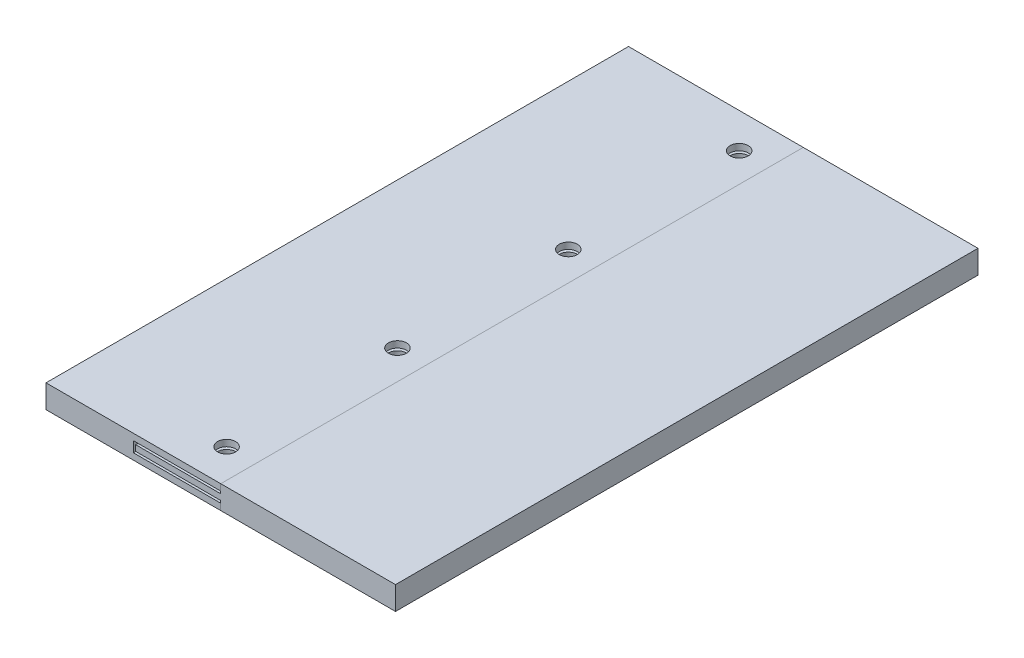
from build123d import *

# Parameters (mm, degrees)
SKETCH1_W           = 30
SKETCH1_H           = 100
BOSS_EXTRUDE1_DEPTH = 4
SKETCH3_W           = 15
SKETCH3_H           = 1.8
CUT_EXTRUDE1_DEPTH  = 100
SKETCH5_W           = 14.6
SKETCH5_H           = 1
BOSS_EXTRUDE3_DEPTH = 100
SKETCH6_R           = 1.55
CUT_EXTRUDE2_DEPTH  = 4


with BuildPart() as part:
    # Sketch1 → Boss-Extrude1 (new body)
    with BuildSketch(Plane(origin=(0, 0, 0), x_dir=(1, 0, 0), z_dir=(0, 1, 0))):
        with Locations((-15, -50)):
            Rectangle(SKETCH1_W, SKETCH1_H)
    extrude(amount=BOSS_EXTRUDE1_DEPTH)


with BuildPart() as body_2:
    # Mirror1: mirrored copy
    add(part.part.mirror(Plane(origin=(0, 4, 0), x_dir=(0, 0, 1), z_dir=(-1, 0, 0))))

    # Sketch5 → Boss-Extrude3 (add)
    with BuildSketch(Plane.XY.offset(100)):
        with Locations((-7.3, 2)):
            Rectangle(SKETCH5_W, SKETCH5_H)
    extrude(amount=-BOSS_EXTRUDE3_DEPTH)


with BuildPart() as part_1:
    add(part.part)

    # Sketch3 → Cut-Extrude1 (cut)
    with BuildSketch(Plane.XY.offset(100)):
        with Locations((-7.5, 2)):
            Rectangle(SKETCH3_W, SKETCH3_H)
    extrude(amount=-CUT_EXTRUDE1_DEPTH, mode=Mode.SUBTRACT)


with BuildPart() as cut_extrude2_tool:
    # Sketch6 → Cut-Extrude2 (new body)
    with BuildSketch(Plane(origin=(0, 4, 0), x_dir=(1, 0, 0), z_dir=(0, 1, 0))):
        with Locations(Location((-5, -6, 0), (0, 0, 270))):
            Circle(SKETCH6_R)
        with Locations(Location((-5, -35.333333333, 0), (0, 0, 270))):
            Circle(SKETCH6_R)
        with Locations(Location((-5, -94, 0), (0, 0, 270))):
            Circle(SKETCH6_R)
        with Locations(Location((-5, -64.666666667, 0), (0, 0, 270))):
            Circle(SKETCH6_R)
    extrude(amount=-CUT_EXTRUDE2_DEPTH)


with BuildPart() as part_2:
    add(part_1.part)

    # Cut-Extrude2: cut by cut_extrude2_tool
    add(cut_extrude2_tool.part, mode=Mode.SUBTRACT)


with BuildPart() as body_2_1:
    add(body_2.part)

    # Cut-Extrude2: cut by cut_extrude2_tool
    add(cut_extrude2_tool.part, mode=Mode.SUBTRACT)


solid = Compound([part_2.part, body_2_1.part])
